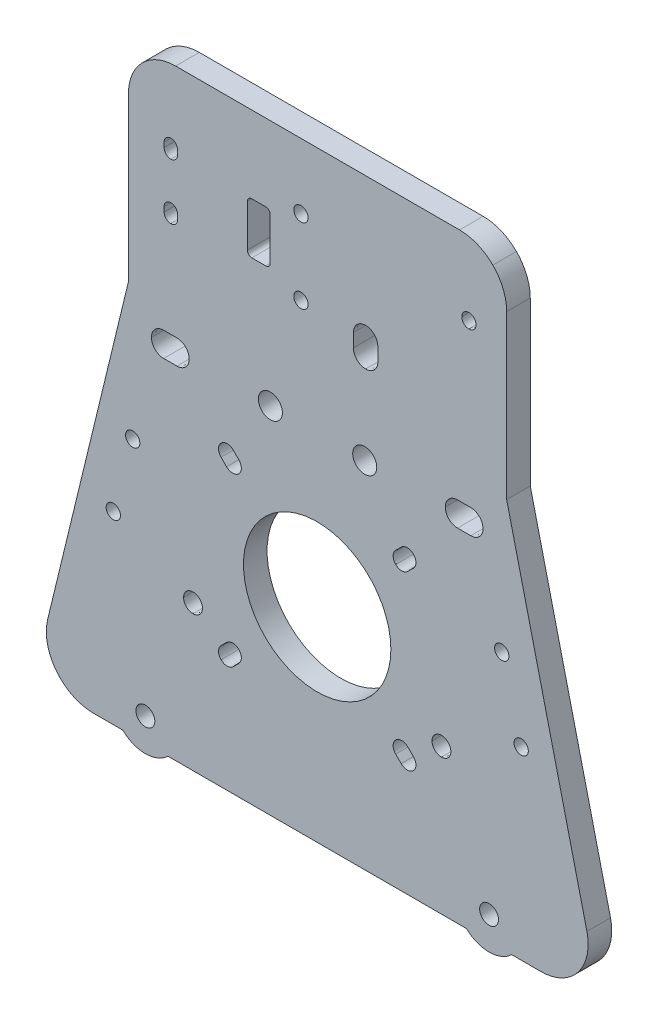
from build123d import *

# Parameters (mm, degrees)
MODEL_R             = 3.24035
MODEL_R_2           = 19.8387
MODEL_R_3           = 2.5396
MODEL_R_4           = 1.9251
MODEL_R_5           = 1.9249
MODEL_R_6           = 1.925069784
MODEL_R_7           = 1.925456162
MODEL_R_8           = 1.925082723
BOSS_EXTRUDE1_DEPTH = 6.35


with BuildPart() as part:
    # Model → Boss-Extrude1 (new body)
    with BuildSketch(Plane.XY):
        with BuildLine():
            Line((-223.3908, -30.6861), (-223.3908, -74.5286))
            Line((-223.3908, -74.5286), (-245.197, -164.3888))
            add(Edge.make_bspline(
                [(-245.197, -164.3888), (-246.0683, -168.1592), (-245.1712, -172.1224), (-242.7625, -175.1514)],
                knots=[0.19047619, 0.19047619, 0.19047619, 0.19047619, 0.238095238, 0.238095238, 0.238095238, 0.238095238], degree=3))
            add(Edge.make_bspline(
                [(-242.7625, -175.1514), (-240.3517, -178.1818), (-236.6933, -179.947), (-232.8227, -179.947)],
                knots=[0.238095238, 0.238095238, 0.238095238, 0.238095238, 0.285714286, 0.285714286, 0.285714286, 0.285714286], degree=3))
            Line((-232.8227, -179.947), (-224.9303, -179.947))
            add(Edge.make_bspline(
                [(-224.9303, -179.947), (-223.3514, -181.4573), (-221.2126, -182.3861), (-218.8561, -182.3861)],
                knots=[0.333333333, 0.333333333, 0.333333333, 0.333333333, 0.380952381, 0.380952381, 0.380952381, 0.380952381], degree=3))
            add(Edge.make_bspline(
                [(-218.8561, -182.3861), (-216.4981, -182.3861), (-214.3597, -181.4573), (-212.7815, -179.947)],
                knots=[0.380952381, 0.380952381, 0.380952381, 0.380952381, 0.428571429, 0.428571429, 0.428571429, 0.428571429], degree=3))
            Line((-212.7815, -179.947), (-132.4009, -179.947))
            add(Edge.make_bspline(
                [(-132.4009, -179.947), (-130.8216, -181.4573), (-128.6832, -182.3861), (-126.3263, -182.3861)],
                knots=[0.476190476, 0.476190476, 0.476190476, 0.476190476, 0.523809524, 0.523809524, 0.523809524, 0.523809524], degree=3))
            add(Edge.make_bspline(
                [(-126.3263, -182.3861), (-123.9687, -182.3861), (-121.8299, -181.4573), (-120.2522, -179.947)],
                knots=[0.523809524, 0.523809524, 0.523809524, 0.523809524, 0.571428571, 0.571428571, 0.571428571, 0.571428571], degree=3))
            Line((-120.2522, -179.947), (-112.3602, -179.947))
            add(Edge.make_bspline(
                [(-112.3602, -179.947), (-108.4892, -179.947), (-104.8291, -178.1818), (-102.4204, -175.1514)],
                knots=[0.619047619, 0.619047619, 0.619047619, 0.619047619, 0.666666667, 0.666666667, 0.666666667, 0.666666667], degree=3))
            add(Edge.make_bspline(
                [(-102.4204, -175.1514), (-100.01, -172.1224), (-99.1142, -168.1592), (-99.9855, -164.3888)],
                knots=[0.666666667, 0.666666667, 0.666666667, 0.666666667, 0.714285714, 0.714285714, 0.714285714, 0.714285714], degree=3))
            Line((-99.9855, -164.3888), (-121.5896, -74.5286))
            Line((-121.5896, -74.5286), (-121.5896, -30.6861))
            add(Edge.make_bspline(
                [(-121.5896, -30.6861), (-121.5896, -27.3189), (-122.9277, -24.0883), (-125.309, -21.7057)],
                knots=[0.80952381, 0.80952381, 0.80952381, 0.80952381, 0.857142857, 0.857142857, 0.857142857, 0.857142857], degree=3))
            add(Edge.make_bspline(
                [(-125.309, -21.7057), (-127.6916, -19.3243), (-130.9214, -17.9863), (-134.2894, -17.9863)],
                knots=[0.857142857, 0.857142857, 0.857142857, 0.857142857, 0.904761905, 0.904761905, 0.904761905, 0.904761905], degree=3))
            Line((-134.2894, -17.9863), (-210.6909, -17.9863))
            add(Edge.make_bspline(
                [(-210.6909, -17.9863), (-214.059, -17.9863), (-217.2888, -19.3243), (-219.6718, -21.7057)],
                knots=[0, 0, 0, 0, 0.047619048, 0.047619048, 0.047619048, 0.047619048], degree=3))
            add(Edge.make_bspline(
                [(-219.6718, -21.7057), (-222.0531, -24.0883), (-223.3908, -27.3189), (-223.3908, -30.6861)],
                knots=[0.047619048, 0.047619048, 0.047619048, 0.047619048, 0.095238095, 0.095238095, 0.095238095, 0.095238095], degree=3))
        make_face()
        with Locations((-185.2043, -84.48855)):
            Circle(MODEL_R, mode=Mode.SUBTRACT)
        with Locations((-159.8043, -84.48855)):
            Circle(MODEL_R, mode=Mode.SUBTRACT)
        with Locations((-172.6049, -125.0331)):
            Circle(MODEL_R_2, mode=Mode.SUBTRACT)
        with Locations((-218.8561, -173.597)):
            Circle(MODEL_R_3, mode=Mode.SUBTRACT)
        with Locations((-126.3263, -173.597)):
            Circle(MODEL_R_3, mode=Mode.SUBTRACT)
        with Locations((-176.9718, -35.5703)):
            Circle(MODEL_R_4, mode=Mode.SUBTRACT)
        with Locations((-176.9718, -55.7487)):
            Circle(MODEL_R_5, mode=Mode.SUBTRACT)
        with Locations((-222.26845, -110.7401)):
            Circle(MODEL_R_6, mode=Mode.SUBTRACT)
        with Locations((-227.49165, -130.231)):
            Circle(MODEL_R_7, mode=Mode.SUBTRACT)
        with Locations((-122.91405, -110.7401)):
            Circle(MODEL_R_6, mode=Mode.SUBTRACT)
        with Locations((-117.6912, -130.231)):
            Circle(MODEL_R_8, mode=Mode.SUBTRACT)
        with BuildLine():
            Line((-190.2054, -38.689), (-186.4527, -38.689))
            add(Edge.make_bspline(
                [(-186.4527, -38.689), (-185.7891, -38.689), (-185.2542, -39.2235), (-185.2542, -39.8875)],
                knots=[0.111111111, 0.111111111, 0.111111111, 0.111111111, 0.222222222, 0.222222222, 0.222222222, 0.222222222], degree=3))
            Line((-185.2542, -39.8875), (-185.2542, -51.2593))
            add(Edge.make_bspline(
                [(-185.2542, -51.2593), (-185.2542, -51.9238), (-185.7891, -52.4579), (-186.4527, -52.4579)],
                knots=[0.333333333, 0.333333333, 0.333333333, 0.333333333, 0.444444444, 0.444444444, 0.444444444, 0.444444444], degree=3))
            Line((-186.4527, -52.4579), (-190.2054, -52.4579))
            add(Edge.make_bspline(
                [(-190.2054, -52.4579), (-190.8694, -52.4579), (-191.4039, -51.9238), (-191.4039, -51.2593)],
                knots=[0.555555556, 0.555555556, 0.555555556, 0.555555556, 0.666666667, 0.666666667, 0.666666667, 0.666666667], degree=3))
            Line((-191.4039, -51.2593), (-191.4039, -39.8875))
            add(Edge.make_bspline(
                [(-191.4039, -39.8875), (-191.4039, -39.2235), (-190.8694, -38.689), (-190.2054, -38.689)],
                knots=[0.777777778, 0.777777778, 0.777777778, 0.777777778, 1, 1, 1, 1], degree=3))
        make_face(mode=Mode.SUBTRACT)
        with BuildLine():
            Line((-210.2034, -37.272), (-210.2034, -38.5411))
            add(Edge.make_bspline(
                [(-210.2034, -38.5411), (-210.2034, -39.5416), (-211.0082, -40.3465), (-212.0087, -40.3465)],
                knots=[0.285714286, 0.285714286, 0.285714286, 0.285714286, 0.428571429, 0.428571429, 0.428571429, 0.428571429], degree=3))
            add(Edge.make_bspline(
                [(-212.0087, -40.3465), (-213.0091, -40.3465), (-213.814, -39.5416), (-213.814, -38.5411)],
                knots=[0.428571429, 0.428571429, 0.428571429, 0.428571429, 0.571428571, 0.571428571, 0.571428571, 0.571428571], degree=3))
            Line((-213.814, -38.5411), (-213.814, -37.272))
            add(Edge.make_bspline(
                [(-213.814, -37.272), (-213.814, -36.2715), (-213.0091, -35.4667), (-212.0087, -35.4667)],
                knots=[0.714285714, 0.714285714, 0.714285714, 0.714285714, 1, 1, 1, 1], degree=3))
            add(Edge.make_bspline(
                [(-212.0087, -35.4667), (-211.0082, -35.4667), (-210.2034, -36.2715), (-210.2034, -37.272)],
                knots=[0, 0, 0, 0, 0.142857143, 0.142857143, 0.142857143, 0.142857143], degree=3))
        make_face(mode=Mode.SUBTRACT)
        with BuildLine():
            Line((-210.2034, -52.3121), (-210.2034, -53.5812))
            add(Edge.make_bspline(
                [(-210.2034, -53.5812), (-210.2034, -54.5817), (-211.0082, -55.3861), (-212.0087, -55.3861)],
                knots=[0.285714286, 0.285714286, 0.285714286, 0.285714286, 0.428571429, 0.428571429, 0.428571429, 0.428571429], degree=3))
            add(Edge.make_bspline(
                [(-212.0087, -55.3861), (-213.0091, -55.3861), (-213.814, -54.5817), (-213.814, -53.5812)],
                knots=[0.428571429, 0.428571429, 0.428571429, 0.428571429, 0.571428571, 0.571428571, 0.571428571, 0.571428571], degree=3))
            Line((-213.814, -53.5812), (-213.814, -52.3121))
            add(Edge.make_bspline(
                [(-213.814, -52.3121), (-213.814, -51.3116), (-213.0091, -50.5068), (-212.0087, -50.5068)],
                knots=[0.714285714, 0.714285714, 0.714285714, 0.714285714, 1, 1, 1, 1], degree=3))
            add(Edge.make_bspline(
                [(-212.0087, -50.5068), (-211.0082, -50.5068), (-210.2034, -51.3116), (-210.2034, -52.3121)],
                knots=[0, 0, 0, 0, 0.142857143, 0.142857143, 0.142857143, 0.142857143], degree=3))
        make_face(mode=Mode.SUBTRACT)
        with BuildLine():
            Line((-146.7064, -103.0735), (-148.1907, -104.5577))
            add(Edge.make_bspline(
                [(-148.1907, -104.5577), (-149.1014, -105.4685), (-150.5662, -105.4685), (-151.4757, -104.5577)],
                knots=[0.285714286, 0.285714286, 0.285714286, 0.285714286, 0.428571429, 0.428571429, 0.428571429, 0.428571429], degree=3))
            add(Edge.make_bspline(
                [(-151.4757, -104.5577), (-152.3864, -103.6482), (-152.3864, -102.1835), (-151.4757, -101.2723)],
                knots=[0.428571429, 0.428571429, 0.428571429, 0.428571429, 0.571428571, 0.571428571, 0.571428571, 0.571428571], degree=3))
            Line((-151.4757, -101.2723), (-149.9914, -99.7884))
            add(Edge.make_bspline(
                [(-149.9914, -99.7884), (-149.0807, -98.8773), (-147.6155, -98.8773), (-146.7064, -99.788)],
                knots=[0.714285714, 0.714285714, 0.714285714, 0.714285714, 1, 1, 1, 1], degree=3))
            add(Edge.make_bspline(
                [(-146.7064, -99.788), (-145.7952, -100.6975), (-145.7956, -102.1623), (-146.7064, -103.0735)],
                knots=[0, 0, 0, 0, 0.142857143, 0.142857143, 0.142857143, 0.142857143], degree=3))
        make_face(mode=Mode.SUBTRACT)
        with BuildLine():
            Line((-193.7055, -148.7926), (-195.1911, -150.2781))
            add(Edge.make_bspline(
                [(-195.1911, -150.2781), (-196.1006, -151.1876), (-197.5653, -151.1876), (-198.4761, -150.2781)],
                knots=[0.285714286, 0.285714286, 0.285714286, 0.285714286, 0.428571429, 0.428571429, 0.428571429, 0.428571429], degree=3))
            add(Edge.make_bspline(
                [(-198.4761, -150.2781), (-199.386, -149.3669), (-199.386, -147.9022), (-198.4765, -146.9927)],
                knots=[0.428571429, 0.428571429, 0.428571429, 0.428571429, 0.571428571, 0.571428571, 0.571428571, 0.571428571], degree=3))
            Line((-198.4765, -146.9927), (-196.991, -145.5072))
            add(Edge.make_bspline(
                [(-196.991, -145.5072), (-196.0815, -144.5978), (-194.6163, -144.5973), (-193.7051, -145.5072)],
                knots=[0.714285714, 0.714285714, 0.714285714, 0.714285714, 1, 1, 1, 1], degree=3))
            add(Edge.make_bspline(
                [(-193.7051, -145.5072), (-192.7956, -146.4181), (-192.796, -147.8832), (-193.7055, -148.7926)],
                knots=[0, 0, 0, 0, 0.142857143, 0.142857143, 0.142857143, 0.142857143], degree=3))
        make_face(mode=Mode.SUBTRACT)
        with BuildLine():
            Line((-196.991, -104.5577), (-198.4765, -103.0735))
            add(Edge.make_bspline(
                [(-198.4765, -103.0735), (-199.386, -102.1623), (-199.3856, -100.6975), (-198.4761, -99.788)],
                knots=[0.285714286, 0.285714286, 0.285714286, 0.285714286, 0.428571429, 0.428571429, 0.428571429, 0.428571429], degree=3))
            add(Edge.make_bspline(
                [(-198.4761, -99.788), (-197.5653, -98.8773), (-196.1006, -98.8773), (-195.1911, -99.788)],
                knots=[0.428571429, 0.428571429, 0.428571429, 0.428571429, 0.571428571, 0.571428571, 0.571428571, 0.571428571], degree=3))
            Line((-195.1911, -99.788), (-193.7055, -101.2723))
            add(Edge.make_bspline(
                [(-193.7055, -101.2723), (-192.796, -102.183), (-192.796, -103.6478), (-193.7055, -104.5569)],
                knots=[0.714285714, 0.714285714, 0.714285714, 0.714285714, 1, 1, 1, 1], degree=3))
            add(Edge.make_bspline(
                [(-193.7055, -104.5569), (-194.6163, -105.4681), (-196.0815, -105.4685), (-196.991, -104.5577)],
                knots=[0, 0, 0, 0, 0.142857143, 0.142857143, 0.142857143, 0.142857143], degree=3))
        make_face(mode=Mode.SUBTRACT)
        with BuildLine():
            Line((-149.9914, -150.2778), (-151.4757, -148.7923))
            add(Edge.make_bspline(
                [(-151.4757, -148.7923), (-152.3864, -147.8828), (-152.3864, -146.4181), (-151.4757, -145.5072)],
                knots=[0.285714286, 0.285714286, 0.285714286, 0.285714286, 0.428571429, 0.428571429, 0.428571429, 0.428571429], degree=3))
            add(Edge.make_bspline(
                [(-151.4757, -145.5072), (-150.5662, -144.5978), (-149.1014, -144.5978), (-148.1907, -145.5072)],
                knots=[0.428571429, 0.428571429, 0.428571429, 0.428571429, 0.571428571, 0.571428571, 0.571428571, 0.571428571], degree=3))
            Line((-148.1907, -145.5072), (-146.7064, -146.9927))
            add(Edge.make_bspline(
                [(-146.7064, -146.9927), (-145.7956, -147.9022), (-145.7952, -149.3672), (-146.7064, -150.2781)],
                knots=[0.714285714, 0.714285714, 0.714285714, 0.714285714, 1, 1, 1, 1], degree=3))
            add(Edge.make_bspline(
                [(-146.7064, -150.2781), (-147.6155, -151.1876), (-149.0807, -151.1873), (-149.9914, -150.2778)],
                knots=[0, 0, 0, 0, 0.142857143, 0.142857143, 0.142857143, 0.142857143], degree=3))
        make_face(mode=Mode.SUBTRACT)
        with BuildLine():
            Line((-213.9323, -81.1983), (-210.3512, -81.1983))
            add(Edge.make_bspline(
                [(-210.3512, -81.1983), (-208.5289, -81.1983), (-207.0612, -82.666), (-207.0612, -84.4875)],
                knots=[0.142857143, 0.142857143, 0.142857143, 0.142857143, 0.285714286, 0.285714286, 0.285714286, 0.285714286], degree=3))
            add(Edge.make_bspline(
                [(-207.0612, -84.4875), (-207.0612, -86.3107), (-208.5289, -87.7771), (-210.3512, -87.7771)],
                knots=[0.285714286, 0.285714286, 0.285714286, 0.285714286, 0.428571429, 0.428571429, 0.428571429, 0.428571429], degree=3))
            Line((-210.3512, -87.7771), (-213.9323, -87.7771))
            add(Edge.make_bspline(
                [(-213.9323, -87.7771), (-215.7543, -87.7771), (-217.2215, -86.3107), (-217.2215, -84.4875)],
                knots=[0.571428571, 0.571428571, 0.571428571, 0.571428571, 0.714285714, 0.714285714, 0.714285714, 0.714285714], degree=3))
            add(Edge.make_bspline(
                [(-217.2215, -84.4875), (-217.2215, -82.666), (-215.7543, -81.1983), (-213.9323, -81.1983)],
                knots=[0.714285714, 0.714285714, 0.714285714, 0.714285714, 1, 1, 1, 1], degree=3))
        make_face(mode=Mode.SUBTRACT)
        with BuildLine():
            Line((-134.83, -81.1983), (-131.2501, -81.1983))
            add(Edge.make_bspline(
                [(-131.2501, -81.1983), (-129.427, -81.1983), (-127.961, -82.666), (-127.961, -84.4875)],
                knots=[0.142857143, 0.142857143, 0.142857143, 0.142857143, 0.285714286, 0.285714286, 0.285714286, 0.285714286], degree=3))
            add(Edge.make_bspline(
                [(-127.961, -84.4875), (-127.961, -86.3107), (-129.427, -87.7771), (-131.2501, -87.7771)],
                knots=[0.285714286, 0.285714286, 0.285714286, 0.285714286, 0.428571429, 0.428571429, 0.428571429, 0.428571429], degree=3))
            Line((-131.2501, -87.7771), (-134.83, -87.7771))
            add(Edge.make_bspline(
                [(-134.83, -87.7771), (-136.6532, -87.7771), (-138.12, -86.3107), (-138.12, -84.4875)],
                knots=[0.571428571, 0.571428571, 0.571428571, 0.571428571, 0.714285714, 0.714285714, 0.714285714, 0.714285714], degree=3))
            add(Edge.make_bspline(
                [(-138.12, -84.4875), (-138.12, -82.666), (-136.6532, -81.1983), (-134.83, -81.1983)],
                knots=[0.714285714, 0.714285714, 0.714285714, 0.714285714, 1, 1, 1, 1], degree=3))
        make_face(mode=Mode.SUBTRACT)
        with BuildLine():
            Line((-156.2737, -56.1744), (-156.2737, -59.7564))
            add(Edge.make_bspline(
                [(-156.2737, -59.7564), (-156.2737, -61.5779), (-157.7401, -63.0455), (-159.5637, -63.0455)],
                knots=[0.142857143, 0.142857143, 0.142857143, 0.142857143, 0.285714286, 0.285714286, 0.285714286, 0.285714286], degree=3))
            add(Edge.make_bspline(
                [(-159.5637, -63.0455), (-161.3852, -63.0455), (-162.8529, -61.5779), (-162.8529, -59.7564)],
                knots=[0.285714286, 0.285714286, 0.285714286, 0.285714286, 0.428571429, 0.428571429, 0.428571429, 0.428571429], degree=3))
            Line((-162.8529, -59.7564), (-162.8529, -56.1744))
            add(Edge.make_bspline(
                [(-162.8529, -56.1744), (-162.8529, -54.3529), (-161.3852, -52.8852), (-159.5637, -52.8852)],
                knots=[0.571428571, 0.571428571, 0.571428571, 0.571428571, 0.714285714, 0.714285714, 0.714285714, 0.714285714], degree=3))
            add(Edge.make_bspline(
                [(-159.5637, -52.8852), (-157.7401, -52.8852), (-156.2737, -54.3529), (-156.2737, -56.1744)],
                knots=[0.714285714, 0.714285714, 0.714285714, 0.714285714, 1, 1, 1, 1], degree=3))
        make_face(mode=Mode.SUBTRACT)
        with BuildLine():
            add(Edge.make_bspline(
                [(-129.8269, -37.9074), (-129.8269, -38.9701), (-130.6878, -39.8311), (-131.7506, -39.8311)],
                knots=[0, 0, 0, 0, 0.2, 0.2, 0.2, 0.2], degree=3))
            add(Edge.make_bspline(
                [(-131.7506, -39.8311), (-132.8142, -39.8311), (-133.6755, -38.9701), (-133.6755, -37.9074)],
                knots=[0.2, 0.2, 0.2, 0.2, 0.4, 0.4, 0.4, 0.4], degree=3))
            add(Edge.make_bspline(
                [(-133.6755, -37.9074), (-133.6755, -36.8438), (-132.8142, -35.9821), (-131.7506, -35.9821)],
                knots=[0.4, 0.4, 0.4, 0.4, 0.6, 0.6, 0.6, 0.6], degree=3))
            add(Edge.make_bspline(
                [(-131.7506, -35.9821), (-130.6878, -35.9821), (-129.8269, -36.8438), (-129.8269, -37.9074)],
                knots=[0.6, 0.6, 0.6, 0.6, 1, 1, 1, 1], degree=3))
        make_face(mode=Mode.SUBTRACT)
        with BuildLine():
            add(Edge.make_bspline(
                [(-136.6079, -140.801), (-136.6079, -139.3985), (-137.745, -138.2615), (-139.1479, -138.2615)],
                knots=[0, 0, 0, 0, 0.2, 0.2, 0.2, 0.2], degree=3))
            add(Edge.make_bspline(
                [(-139.1479, -138.2615), (-140.5504, -138.2615), (-141.6875, -139.3985), (-141.6875, -140.801)],
                knots=[0.2, 0.2, 0.2, 0.2, 0.4, 0.4, 0.4, 0.4], degree=3))
            add(Edge.make_bspline(
                [(-141.6875, -140.801), (-141.6875, -142.2041), (-140.5504, -143.3408), (-139.1479, -143.3408)],
                knots=[0.4, 0.4, 0.4, 0.4, 0.6, 0.6, 0.6, 0.6], degree=3))
            add(Edge.make_bspline(
                [(-139.1479, -143.3408), (-137.745, -143.3408), (-136.6079, -142.2041), (-136.6079, -140.801)],
                knots=[0.6, 0.6, 0.6, 0.6, 1, 1, 1, 1], degree=3))
        make_face(mode=Mode.SUBTRACT)
        with BuildLine():
            add(Edge.make_bspline(
                [(-203.4938, -140.801), (-203.4938, -139.3985), (-204.6321, -138.2615), (-206.035, -138.2615)],
                knots=[0, 0, 0, 0, 0.2, 0.2, 0.2, 0.2], degree=3))
            add(Edge.make_bspline(
                [(-206.035, -138.2615), (-207.4379, -138.2615), (-208.5745, -139.3985), (-208.5745, -140.801)],
                knots=[0.2, 0.2, 0.2, 0.2, 0.4, 0.4, 0.4, 0.4], degree=3))
            add(Edge.make_bspline(
                [(-208.5745, -140.801), (-208.5745, -142.2041), (-207.4379, -143.3408), (-206.035, -143.3408)],
                knots=[0.4, 0.4, 0.4, 0.4, 0.6, 0.6, 0.6, 0.6], degree=3))
            add(Edge.make_bspline(
                [(-206.035, -143.3408), (-204.6321, -143.3408), (-203.4938, -142.2041), (-203.4938, -140.801)],
                knots=[0.6, 0.6, 0.6, 0.6, 1, 1, 1, 1], degree=3))
        make_face(mode=Mode.SUBTRACT)
    extrude(amount=BOSS_EXTRUDE1_DEPTH)


solid = part.part
